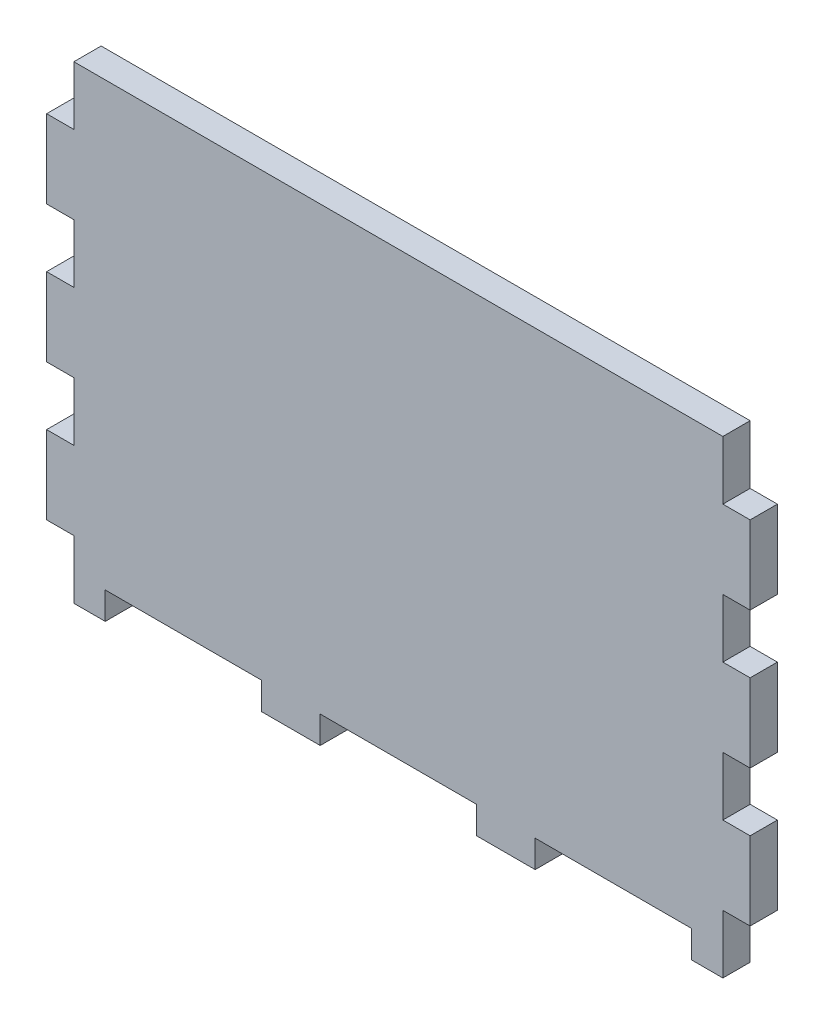
from build123d import *

# Parameters (mm, degrees)
BASE_SKETCH_W           = 304.8
BASE_SKETCH_H           = 191.39
BOSS_EXTRUDE1_DEPTH     = 11.81
JOINT_X_W               = 25.4
JOINT_X_H               = 11.81
BOSS_EXTRUDE2_DEPTH     = 11.81
JOINT_Y_W               = 11.81
JOINT_Y_H               = 25.4
CUT_EXTRUDE1_DEPTH      = 384.912686042
LPATTERN1_COUNT         = 4
LPATTERN1_PITCH         = 93.133333333
LPATTERN2_COUNT         = 4
LPATTERN2_PITCH         = 59.266666667
MIRROR1_COPY_1_SKETCH_W = 11.81
MIRROR1_COPY_1_SKETCH_H = 25.4
MIRROR1_COPY_1_DEPTH    = 384.912686042
MIRROR1_COPY_2_SKETCH_W = 11.81
MIRROR1_COPY_2_SKETCH_H = 25.4
MIRROR1_COPY_2_DEPTH    = 384.912686042
MIRROR1_COPY_3_SKETCH_W = 11.81
MIRROR1_COPY_3_SKETCH_H = 25.4
MIRROR1_COPY_3_DEPTH    = 384.912686042


with BuildPart() as part:
    # Base_Sketch → Boss-Extrude1 (new body)
    with BuildSketch(Plane.XY):
        with Locations((-199.719002607, -45.012810132)):
            Rectangle(BASE_SKETCH_W, BASE_SKETCH_H)
    extrude(amount=BOSS_EXTRUDE1_DEPTH)

    # Joint_X → Boss-Extrude2 (add)
    with BuildSketch(Plane.XY.offset(11.81)):
        with Locations((-339.419002607, -146.612810132)):
            Rectangle(JOINT_X_W, JOINT_X_H)
    boss_extrude2 = extrude(amount=-BOSS_EXTRUDE2_DEPTH)

    # Joint_Y → Cut-Extrude1 (cut, through all)
    with BuildSketch(Plane.XY.offset(11.81)):
        with Locations((-346.214002607, -139.817810132)):
            Rectangle(JOINT_Y_W, JOINT_Y_H)
    cut_extrude1 = extrude(amount=-CUT_EXTRUDE1_DEPTH, mode=Mode.SUBTRACT)

    # LPattern1: Boss-Extrude2 ×4
    with Locations(*[(i * LPATTERN1_PITCH, 0, 0) for i in range(1, LPATTERN1_COUNT)]):
        add(boss_extrude2)

    # LPattern2: Cut-Extrude1 ×4
    with Locations(*[(0, i * LPATTERN2_PITCH, 0) for i in range(1, LPATTERN2_COUNT)]):
        add(cut_extrude1, mode=Mode.SUBTRACT)

    # Mirror1: Cut-Extrude1 across plane
    add(cut_extrude1.mirror(Plane.ZY.offset(199.719002607)), mode=Mode.SUBTRACT)

    # Mirror1 copy 1 sketch → Mirror1 copy 1 (cut, through all)
    with BuildSketch(Plane(origin=(-399.438005213, 59.266666667, 11.81), x_dir=(-1, 0, 0), z_dir=(0, 0, 1))):
        with Locations((-346.214002607, 139.817810132)):
            Rectangle(MIRROR1_COPY_1_SKETCH_W, MIRROR1_COPY_1_SKETCH_H)
    extrude(amount=-MIRROR1_COPY_1_DEPTH, mode=Mode.SUBTRACT)

    # Mirror1 copy 2 sketch → Mirror1 copy 2 (cut, through all)
    with BuildSketch(Plane(origin=(-399.438005213, 118.533333333, 11.81), x_dir=(-1, 0, 0), z_dir=(0, 0, 1))):
        with Locations((-346.214002607, 139.817810132)):
            Rectangle(MIRROR1_COPY_2_SKETCH_W, MIRROR1_COPY_2_SKETCH_H)
    extrude(amount=-MIRROR1_COPY_2_DEPTH, mode=Mode.SUBTRACT)

    # Mirror1 copy 3 sketch → Mirror1 copy 3 (cut, through all)
    with BuildSketch(Plane(origin=(-399.438005213, 177.8, 11.81), x_dir=(-1, 0, 0), z_dir=(0, 0, 1))):
        with Locations((-346.214002607, 139.817810132)):
            Rectangle(MIRROR1_COPY_3_SKETCH_W, MIRROR1_COPY_3_SKETCH_H)
    extrude(amount=-MIRROR1_COPY_3_DEPTH, mode=Mode.SUBTRACT)


solid = part.part
